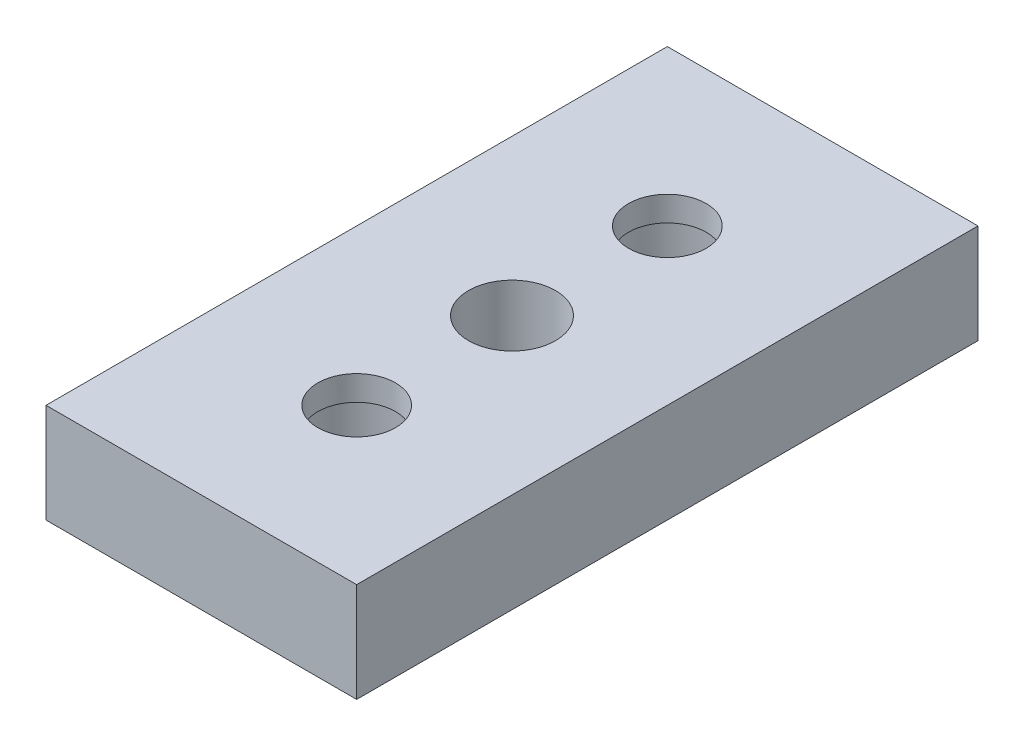
from build123d import *

# Parameters (mm, degrees)
SKETCH_1_W              = 50
SKETCH_1_H              = 100
SKETCH_1_R              = 6.25
EXTRUDE_1_DEPTH         = 16
HOLE_WIZARD_M16_1_D     = 14
HOLE_WIZARD_M16_1_DEPTH = 38
HOLE_WIZARD_M16_1_TIP   = 4.206024333
SKETCH_5_R              = 9.25
CUT_EXTRUDE_1_DEPTH     = 12


with BuildPart() as part:
    # 草图1 → 凸台-拉伸1 (new body)
    with BuildSketch(Plane(origin=(0, 0, 0), x_dir=(1, 0, 0), z_dir=(0, 1, 0))):
        with Locations((25, 50)):
            Rectangle(SKETCH_1_W, SKETCH_1_H)
        with Locations(Location((25, 75, 0), (0, 0, 270))):
            Circle(SKETCH_1_R, mode=Mode.SUBTRACT)
        with Locations(Location((25, 25, 0), (0, 0, 270))):
            Circle(SKETCH_1_R, mode=Mode.SUBTRACT)
    extrude(amount=EXTRUDE_1_DEPTH)

    # M16 螺纹孔1
    with Locations(Plane(origin=(25, 16, -50), x_dir=(0, 0, 1), z_dir=(0, 1, 0))):
        with Locations((0, 0)):
            Hole(HOLE_WIZARD_M16_1_D / 2, depth=HOLE_WIZARD_M16_1_DEPTH)
            with Locations((0, 0, -(HOLE_WIZARD_M16_1_DEPTH + HOLE_WIZARD_M16_1_TIP / 2))):  # 118° drill point
                Cone(0, HOLE_WIZARD_M16_1_D / 2, HOLE_WIZARD_M16_1_TIP, mode=Mode.SUBTRACT)

    # 草图5 → 切除-拉伸1 (cut)
    with BuildSketch(Plane.XZ):
        with Locations(Location((25, -25, 0), (0, 0, 270))):
            Circle(SKETCH_5_R)
        with Locations(Location((25, -75, 0), (0, 0, 270))):
            Circle(SKETCH_5_R)
    extrude(amount=-CUT_EXTRUDE_1_DEPTH, mode=Mode.SUBTRACT)


solid = part.part
